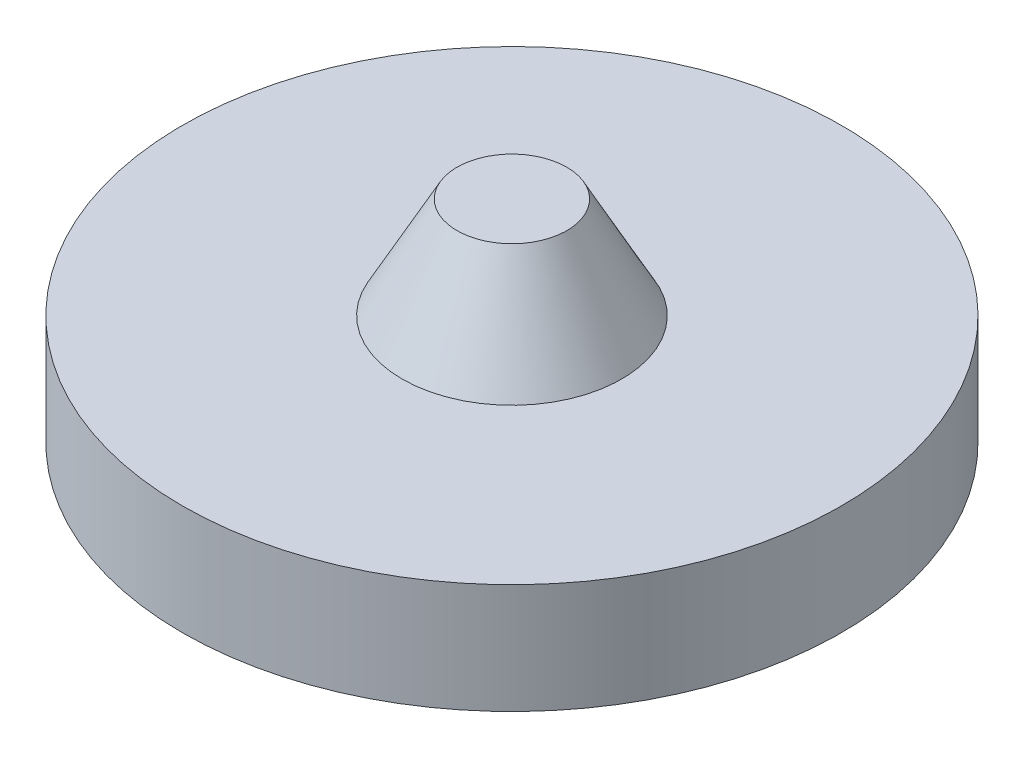
from build123d import *

# Parameters (mm, degrees)
SKETCH1_R           = 6
BOSS_EXTRUDE1_DEPTH = 1


with BuildPart() as part:
    # Sketch1 → Boss-Extrude1 (new, symmetric)
    with BuildSketch(Plane(origin=(0, 0, 0), x_dir=(1, 0, 0), z_dir=(0, 1, 0))):
        Circle(SKETCH1_R)
    extrude(amount=BOSS_EXTRUDE1_DEPTH, both=True)

    # Sketch3 → Revolve1 (revolve)
    with BuildSketch(Plane(origin=(0, 0, 0), x_dir=(0, 0, -1), z_dir=(1, 0, 0))):
        Polygon((0, 1), (-2, 1), (-1, 2.84), (0, 2.84), align=None)
    revolve(axis=Axis((0, 1, 0), (0, 1, 0)))


solid = part.part
